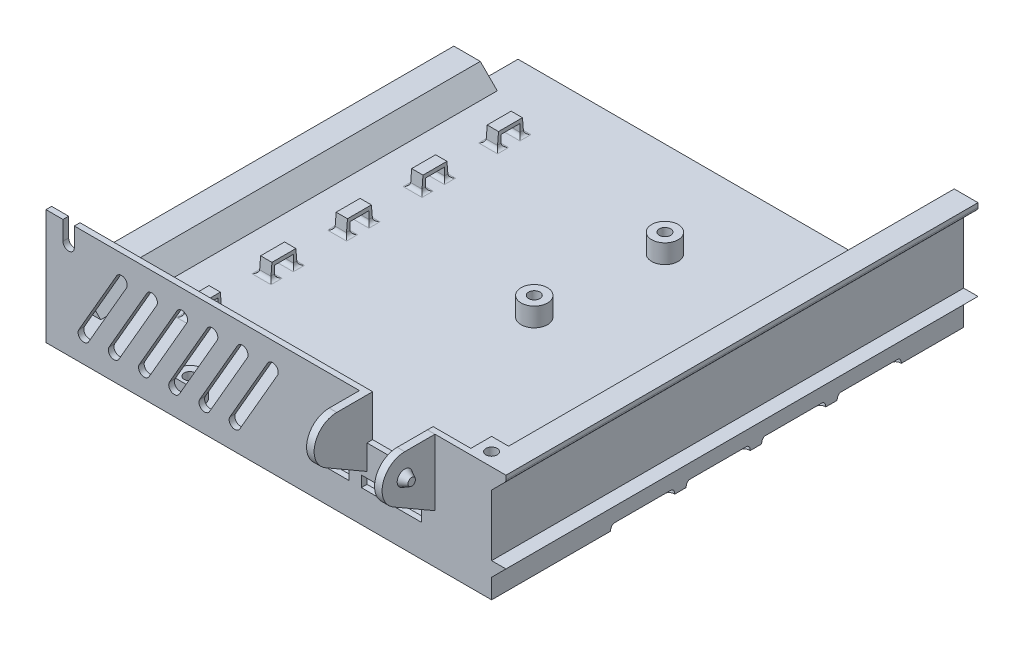
from build123d import *

# Parameters (mm, degrees)
SKETCH2_W           = 118
SKETCH2_H           = 125
BOSS_EXTRUDE1_DEPTH = 2.5
SKETCH3_R           = 3.5
SKETCH3_R_2         = 1.5
BOSS_EXTRUDE2_DEPTH = 5
SKETCH5_W           = 118
SKETCH5_H           = 1.5
BOSS_EXTRUDE3_DEPTH = 28
SKETCH6_W           = 9
SKETCH6_H           = 5.1
SKETCH6_W_2         = 16
SKETCH6_H_2         = 2.9
CUT_EXTRUDE1_DEPTH  = 1.5
SKETCH7_W           = 2.5
SKETCH7_H           = 2
BOSS_EXTRUDE4_DEPTH = 125
FILLET1_R           = 1
BOSS_EXTRUDE5_START = -10
SKETCH9_R           = 1.5
BOSS_EXTRUDE5_DEPTH = 105
SKETCH12_W          = 7
SKETCH12_H          = 7
BOSS_EXTRUDE7_DEPTH = 28
SKETCH13_R          = 1.5
CUT_EXTRUDE3_DEPTH  = 10
BOSS_EXTRUDE8_START = -25
BOSS_EXTRUDE8_DEPTH = 3
LPATTERN1_COUNT     = 5
LPATTERN1_PITCH     = 20
FILLET2_R           = 1
CUT_EXTRUDE4_DEPTH  = 1.5
LPATTERN2_COUNT     = 6
LPATTERN2_PITCH     = 8
CUT_EXTRUDE5_DEPTH  = 169.963575956
LPATTERN3_COUNT     = 4
LPATTERN3_PITCH     = 20
BOSS_EXTRUDE9_DEPTH = 2
SKETCH25_W          = 16
SKETCH25_H          = 11
CUT_EXTRUDE6_DEPTH  = 1.5
CUT_EXTRUDE7_DEPTH  = 1.5


with BuildPart() as part:
    # Sketch2 → Boss-Extrude1 (new body)
    with BuildSketch(Plane(origin=(0, 0, 0), x_dir=(1, 0, 0), z_dir=(0, 1, 0))):
        with Locations((66, 62.5)):
            Rectangle(SKETCH2_W, SKETCH2_H)
    extrude(amount=BOSS_EXTRUDE1_DEPTH)

    # Sketch3 → Boss-Extrude2 (add)
    # profile 1 of 5: a face of its own
    with BuildSketch(Plane(origin=(0, 2.5, 0), x_dir=(1, 0, 0), z_dir=(0, 1, 0))):
        with Locations(Location((41.25, 3.85, 0), (0, 0, 270))):
            Circle(SKETCH3_R)
        with Locations(Location((41.25, 3.85, 0), (0, 0, 270))):
            Circle(SKETCH3_R_2, mode=Mode.SUBTRACT)
    # profile 2 of 5: a face of its own
    with BuildSketch(Plane(origin=(0, 2.5, 0), x_dir=(1, 0, 0), z_dir=(0, 1, 0))):
        with Locations(Location((106, 19.6, 0), (0, 0, 270))):
            Circle(SKETCH3_R)
        with Locations(Location((106, 19.6, 0), (0, 0, 270))):
            Circle(SKETCH3_R_2, mode=Mode.SUBTRACT)
    # profile 3 of 5: a face of its own
    with BuildSketch(Plane(origin=(0, 2.5, 0), x_dir=(1, 0, 0), z_dir=(0, 1, 0))):
        with Locations(Location((68.3, 68, 0), (0, 0, 270))):
            Circle(SKETCH3_R)
        with Locations(Location((68.3, 68, 0), (0, 0, 270))):
            Circle(SKETCH3_R_2, mode=Mode.SUBTRACT)
    # profile 4 of 5: a face of its own
    with BuildSketch(Plane(origin=(0, 2.5, 0), x_dir=(1, 0, 0), z_dir=(0, 1, 0))):
        with Locations(Location((106, 81.6, 0), (0, 0, 270))):
            Circle(SKETCH3_R)
        with Locations(Location((106, 81.6, 0), (0, 0, 270))):
            Circle(SKETCH3_R_2, mode=Mode.SUBTRACT)
    # profile 5 of 5: a face of its own
    with BuildSketch(Plane(origin=(0, 2.5, 0), x_dir=(1, 0, 0), z_dir=(0, 1, 0))):
        with Locations(Location((71.1, 99.8, 0), (0, 0, 270))):
            Circle(SKETCH3_R)
        with Locations(Location((71.1, 99.8, 0), (0, 0, 270))):
            Circle(SKETCH3_R_2, mode=Mode.SUBTRACT)
    extrude(amount=BOSS_EXTRUDE2_DEPTH)

    # Sketch5 → Boss-Extrude3 (add)
    with BuildSketch(Plane(origin=(0, 2.5, 0), x_dir=(1, 0, 0), z_dir=(0, 1, 0))):
        with Locations((66, 0.75)):
            Rectangle(SKETCH5_W, SKETCH5_H)
    extrude(amount=BOSS_EXTRUDE3_DEPTH)

    # Sketch6 → Cut-Extrude1 (cut)
    with BuildSketch(Plane.XY):
        with Locations((82.7, 11.05)):
            Rectangle(SKETCH6_W, SKETCH6_H)
        with Locations((98.5, 9.95)):
            Rectangle(SKETCH6_W_2, SKETCH6_H_2)
    extrude(amount=-CUT_EXTRUDE1_DEPTH, mode=Mode.SUBTRACT)

    # Sketch7 → Boss-Extrude4 (add)
    with BuildSketch(Plane.XY):
        Polygon((122.5, 0), (125, 0), (125, 5.2), (125, 7), (122.5, 7), align=None)
        Polygon((125, 7), (125, 5.2), (126.8, 7), align=None)
        Polygon((125, 7), (126.8, 7), (128.8, 9), (125, 9), align=None)
        with Locations((123.75, 8)):
            Rectangle(SKETCH7_W, SKETCH7_H)
        Polygon((122.5, 9), (125, 9), (125, 25.2), (125, 30.5), (122.5, 30.5), align=None)
        Polygon((125, 30.5), (125, 25.2), (126.8, 27), (128.8, 29), (128.8, 30.5), align=None)
    extrude(amount=-BOSS_EXTRUDE4_DEPTH)

    # Fillet1
    fillet1_edges = [part.edges().sort_by_distance(p)[0] for p in [
        (128.8, 29, -62.5),
    ]]
    fillet(fillet1_edges, radius=FILLET1_R)

    # Sketch9 → Boss-Extrude5 (add)
    # profile 1 of 2: a face of its own
    with BuildSketch(Plane.XY.offset(BOSS_EXTRUDE5_START)):
        Polygon((7, 2.5), (7, 7), (0, 7), (0, 0), (7, 0), align=None)
        with Locations((3.5, 3.5)):
            Circle(SKETCH9_R, mode=Mode.SUBTRACT)
    # profile 2 of 2: a face of its own
    with BuildSketch(Plane.XY.offset(BOSS_EXTRUDE5_START)):
        Polygon((11.5, 2.5), (7, 7), (7, 2.5), align=None)
    extrude(amount=-BOSS_EXTRUDE5_DEPTH)

    # Sketch12 → Boss-Extrude7 (add)
    with BuildSketch(Plane(origin=(0, 30.5, 0), x_dir=(1, 0, 0), z_dir=(0, 1, 0))):
        with Locations((121.5, 3.5)):
            Rectangle(SKETCH12_W, SKETCH12_H)
    extrude(amount=-BOSS_EXTRUDE7_DEPTH)

    # Sketch13 → Cut-Extrude3 (cut)
    with BuildSketch(Plane(origin=(0, 30.5, 0), x_dir=(1, 0, 0), z_dir=(0, 1, 0))):
        with Locations(Location((121.5, 3.5, 0), (0, 0, 270))):
            Circle(SKETCH13_R)
    extrude(amount=-CUT_EXTRUDE3_DEPTH, mode=Mode.SUBTRACT)

    # Sketch15 → Boss-Extrude8 (add)
    with BuildSketch(Plane.ZY.offset(BOSS_EXTRUDE8_START)):
        Polygon((-107.5, 2.5), (-108.5, 2.5), (-108.170062731, 6.5), (-101.829937269, 6.5), (-101.5, 2.5), (-102.5, 2.5), (-102.5, 5.5), (-107.5, 5.5), align=None)
    boss_extrude8 = extrude(amount=BOSS_EXTRUDE8_DEPTH)

    # LPattern1: Boss-Extrude8 ×5
    with Locations(*[(0, 0, i * LPATTERN1_PITCH) for i in range(1, LPATTERN1_COUNT)]):
        add(boss_extrude8)

    # Fillet2
    fillet2_edges = [part.edges().sort_by_distance(p)[0] for p in [
        (23.5, 2.5, -107.5),
        (25, 2.5, -102),
        (23.5, 2.5, -102.5),
        (23.5, 2.5, -101.5),
        (25, 2.5, -108),
        (23.5, 2.5, -108.5),
        (22, 2.5, -102),
        (22, 2.5, -108),
        (23.5, 2.5, -87.5),
        (25, 2.5, -82),
        (23.5, 2.5, -82.5),
        (23.5, 2.5, -81.5),
        (25, 2.5, -88),
        (23.5, 2.5, -88.5),
        (22, 2.5, -82),
        (22, 2.5, -88),
        (23.5, 2.5, -67.5),
        (25, 2.5, -62),
        (23.5, 2.5, -62.5),
        (23.5, 2.5, -61.5),
        (25, 2.5, -68),
        (23.5, 2.5, -68.5),
        (22, 2.5, -62),
        (22, 2.5, -68),
        (23.5, 2.5, -47.5),
        (25, 2.5, -42),
        (23.5, 2.5, -42.5),
        (23.5, 2.5, -41.5),
        (25, 2.5, -48),
        (23.5, 2.5, -48.5),
        (22, 2.5, -42),
        (22, 2.5, -48),
        (23.5, 2.5, -27.5),
        (25, 2.5, -22),
        (23.5, 2.5, -22.5),
        (23.5, 2.5, -21.5),
        (25, 2.5, -28),
        (23.5, 2.5, -28.5),
        (22, 2.5, -22),
        (22, 2.5, -28),
    ]]
    fillet(fillet2_edges, radius=FILLET2_R)

    # Sketch16 → Cut-Extrude4 (cut)
    with BuildSketch(Plane.XY):
        with BuildLine():
            Line((28.299038106, 23.160254038), (18.299038106, 5.839745962))
            ThreePointArc((18.299038106, 5.839745962), (16.25, 5.290707856), (15.700961894, 7.339745962))
            Line((15.700961894, 7.339745962), (25.700961894, 24.660254038))
            ThreePointArc((25.700961894, 24.660254038), (27.75, 25.209292144), (28.299038106, 23.160254038))
        make_face()
    cut_extrude4 = extrude(amount=-CUT_EXTRUDE4_DEPTH, mode=Mode.SUBTRACT)

    # LPattern2: Cut-Extrude4 ×6
    with Locations(*[(i * LPATTERN2_PITCH, 0, 0) for i in range(1, LPATTERN2_COUNT)]):
        add(cut_extrude4, mode=Mode.SUBTRACT)

    # Sketch18 → Cut-Extrude5 (cut, symmetric)
    with BuildSketch(Plane(origin=(60, -60, 0), x_dir=(0, 0, 1), z_dir=(-0.7071067811865488, 0.7071067811865464, 0))):
        with BuildLine():
            Line((-107.5, 89.388347648), (-92.5, 89.388347648))
            ThreePointArc((-92.5, 89.388347648), (-91.5, 88.388347648), (-92.5, 87.388347648))
            Line((-92.5, 87.388347648), (-107.5, 87.388347648))
            ThreePointArc((-107.5, 87.388347648), (-108.5, 88.388347648), (-107.5, 89.388347648))
        make_face()
    cut_extrude5 = extrude(amount=CUT_EXTRUDE5_DEPTH, both=True, mode=Mode.SUBTRACT)

    # LPattern3: Cut-Extrude5 ×4
    with Locations(*[(0, 0, i * LPATTERN3_PITCH) for i in range(1, LPATTERN3_COUNT)]):
        add(cut_extrude5, mode=Mode.SUBTRACT)


with BuildPart() as body_2:
    # Sketch20 → Boss-Extrude9 (new body)
    with BuildSketch(Plane(origin=(110, 0, 0), x_dir=(0, 0, -1), z_dir=(1, 0, 0))):
        with BuildLine():
            Line((-8, 30.5), (0, 30.5))
            Line((0, 30.5), (0, 12.952994616))
            Line((0, 12.952994616), (-11, 19.303847577))
            ThreePointArc((-11, 19.303847577), (-13.795554958, 26.052914271), (-8, 30.5))
        make_face()
    boss_extrude9 = extrude(amount=-BOSS_EXTRUDE9_DEPTH)

    # Sketch24 → Revolve1 (revolve)
    with BuildSketch(Plane.XY.offset(8), mode=Mode.PRIVATE) as revolve1_sk:
        Polygon((110, 24.5), (111.84, 24.5), (111.84, 25.5), (110, 26.5), align=None)
    revolve1 = revolve(revolve1_sk.sketch.rotate(Axis((110, 24.5, 8), (1, 0, 0)), 90), axis=Axis((110, 24.5, 8), (1, 0, 0)))


with BuildPart() as part_1:
    add(part.part)

    # Mirror2: Boss-Extrude9, Revolve1 across plane
    add(boss_extrude9.mirror(Plane(origin=(100, 0, 0), x_dir=(0, 0, 1), z_dir=(1, 0, 0))))
    add(revolve1.mirror(Plane(origin=(100, 0, 0), x_dir=(0, 0, 1), z_dir=(1, 0, 0))))

    # Sketch25 → Cut-Extrude6 (cut)
    with BuildSketch(Plane.XY):
        with Locations((100, 25)):
            Rectangle(SKETCH25_W, SKETCH25_H)
    extrude(amount=-CUT_EXTRUDE6_DEPTH, mode=Mode.SUBTRACT)

    # Sketch26 → Cut-Extrude7 (cut)
    with BuildSketch(Plane.XY):
        with BuildLine():
            Line((14.5, 25.5), (14.5, 30.5))
            Line((14.5, 30.5), (11.5, 30.5))
            Line((11.5, 30.5), (11.5, 25.5))
            ThreePointArc((11.5, 25.5), (13, 24), (14.5, 25.5))
        make_face()
        with BuildLine():
            Line((11.5, 30.5), (14.5, 30.5))
            ThreePointArc((14.5, 30.5), (13, 32), (11.5, 30.5))
        make_face()
    extrude(amount=-CUT_EXTRUDE7_DEPTH, mode=Mode.SUBTRACT)


solid = Compound([body_2.part, part_1.part])
